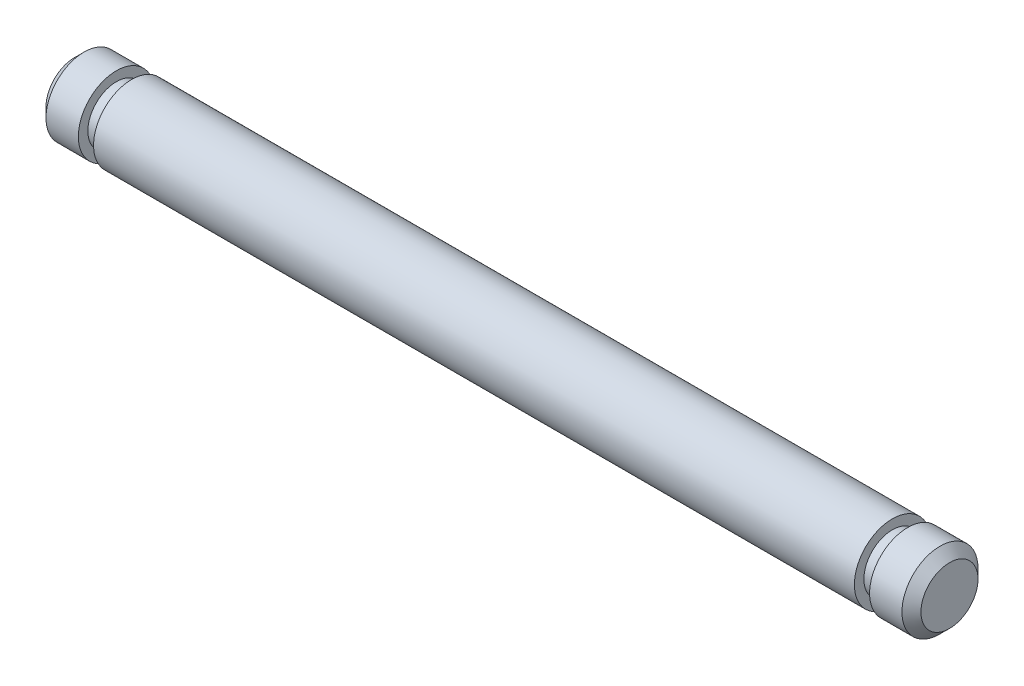
from build123d import *

# Parameters (mm, degrees)
SKETCH1_R           = 2
BOSS_EXTRUDE1_DEPTH = 20
SKETCH2_R           = 1.5
BOSS_EXTRUDE2_DEPTH = 0.8
BOSS_EXTRUDE3_START = 2.2
SKETCH3_R           = 2
BOSS_EXTRUDE3_DEPTH = 2.2
CHAMFER1_SIZE       = 0.5


with BuildPart() as part:
    # Sketch1 → Boss-Extrude1 (new, symmetric)
    with BuildSketch(Plane(origin=(0, 0, 0), x_dir=(0, 0, -1), z_dir=(1, 0, 0))):
        Circle(SKETCH1_R)
    extrude(amount=BOSS_EXTRUDE1_DEPTH, both=True)

    # Sketch2 → Boss-Extrude2 (add)
    with BuildSketch(Plane(origin=(20, 0, 0), x_dir=(0, 0, -1), z_dir=(1, 0, 0))):
        Circle(SKETCH2_R)
    boss_extrude2 = extrude(amount=BOSS_EXTRUDE2_DEPTH)

    # Sketch3 → Boss-Extrude3 (add)
    with BuildSketch(Plane(origin=(20.8, 0, 0), x_dir=(0, 0, -1), z_dir=(1, 0, 0)).offset(BOSS_EXTRUDE3_START)):
        Circle(SKETCH3_R)
    boss_extrude3 = extrude(amount=-BOSS_EXTRUDE3_DEPTH)

    # Mirror1: Boss-Extrude2, Boss-Extrude3 across plane
    add(boss_extrude2.mirror(Plane(origin=(0, 0, 0), x_dir=(0, 0, 1), z_dir=(1, 0, 0))))
    add(boss_extrude3.mirror(Plane(origin=(0, 0, 0), x_dir=(0, 0, 1), z_dir=(1, 0, 0))))

    # Chamfer1
    chamfer1_edges = [part.edges().sort_by_distance(p)[0] for p in [
        (23, 0, 2),
        (-23, 0, 2),
    ]]
    chamfer(chamfer1_edges, length=CHAMFER1_SIZE)


solid = part.part
